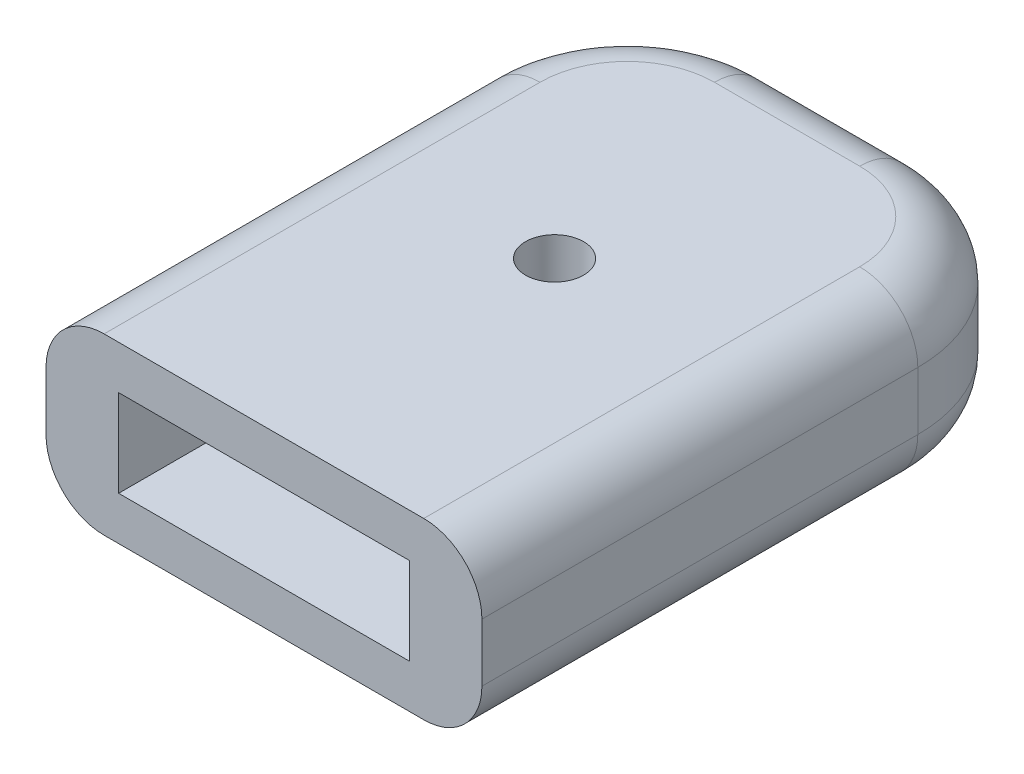
from build123d import *

# Parameters (mm, degrees)
SKETCH1_W           = 15
SKETCH1_H           = 20
BOSS_EXTRUDE1_DEPTH = 6
SKETCH2_W           = 10
SKETCH2_H           = 3
CUT_EXTRUDE1_DEPTH  = 16
FILLET1_R           = 5
FILLET2_R           = 5
FILLET3_R           = 2
SKETCH3_R           = 1
CUT_EXTRUDE2_DEPTH  = 16


with BuildPart() as part:
    # Sketch1 → Boss-Extrude1 (new body)
    with BuildSketch(Plane(origin=(0, 0, 0), x_dir=(1, 0, 0), z_dir=(0, 1, 0))):
        Rectangle(SKETCH1_W, SKETCH1_H)
    extrude(amount=BOSS_EXTRUDE1_DEPTH)

    # Sketch2 → Cut-Extrude1 (cut)
    with BuildSketch(Plane.XY.offset(10)):
        with Locations((0, 3)):
            Rectangle(SKETCH2_W, SKETCH2_H)
    extrude(amount=-CUT_EXTRUDE1_DEPTH, mode=Mode.SUBTRACT)

    # Fillet1
    fillet1_edges = [part.edges().sort_by_distance(p)[0] for p in [
        (7.5, 3, -10),
    ]]
    fillet(fillet1_edges, radius=FILLET1_R)

    # Fillet2
    fillet2_edges = [part.edges().sort_by_distance(p)[0] for p in [
        (-7.5, 3, -10),
    ]]
    fillet(fillet2_edges, radius=FILLET2_R)

    # Fillet3
    fillet3_edges = [part.edges().sort_by_distance(p)[0] for p in [
        (7.5, 6, 2.5),
        (0, 0, -10),
        (0, 6, -10),
        (6.035533906, 0, -8.535533906),
        (6.035533906, 6, -8.535533906),
        (-7.5, 0, 2.5),
        (-7.5, 6, 2.5),
        (-6.035533906, 0, -8.535533906),
        (-6.035533906, 6, -8.535533906),
        (7.5, 0, 2.5),
    ]]
    fillet(fillet3_edges, radius=FILLET3_R)

    # Sketch3 → Cut-Extrude2 (cut)
    with BuildSketch(Plane.XZ):
        with Locations(Location((0, 0, 0), (0, 0, 270))):
            Circle(SKETCH3_R)
    extrude(amount=-CUT_EXTRUDE2_DEPTH, mode=Mode.SUBTRACT)


solid = part.part
